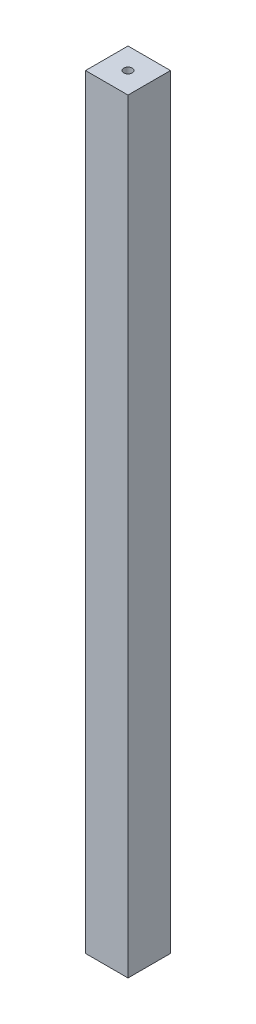
from build123d import *

# Parameters (mm, degrees)
SKETCH_1_W          = 50
SKETCH_1_H          = 50
EXTRUDE_2_DEPTH     = 900
SKETCH_4_R          = 5
CUT_EXTRUDE_2_DEPTH = 50
CUT_EXTRUDE_START   = -50
SKETCH_5_R          = 5
CUT_EXTRUDE_3_DEPTH = 50


with BuildPart() as part:
    # Эскиз1 → Бобышка-Вытянуть2 (new body)
    with BuildSketch(Plane(origin=(0, 0, 0), x_dir=(1, 0, 0), z_dir=(0, 1, 0))):
        Rectangle(SKETCH_1_W, SKETCH_1_H)
    extrude(amount=EXTRUDE_2_DEPTH)

    # Эскиз4 → Вырез-Вытянуть2 (cut)
    with BuildSketch(Plane(origin=(0, 900, 0), x_dir=(1, 0, 0), z_dir=(0, 1, 0))):
        with Locations(Location((0, 0, 0), (0, 0, 270))):
            Circle(SKETCH_4_R)
    extrude(amount=-CUT_EXTRUDE_2_DEPTH, mode=Mode.SUBTRACT)

    # Эскиз5 → Вырез-Вытянуть3 (cut)
    with BuildSketch(Plane.XZ.offset(CUT_EXTRUDE_START)):
        with Locations(Location((0, 0, 0), (0, 0, 90))):
            Circle(SKETCH_5_R)
    extrude(amount=CUT_EXTRUDE_3_DEPTH, mode=Mode.SUBTRACT)


solid = part.part
